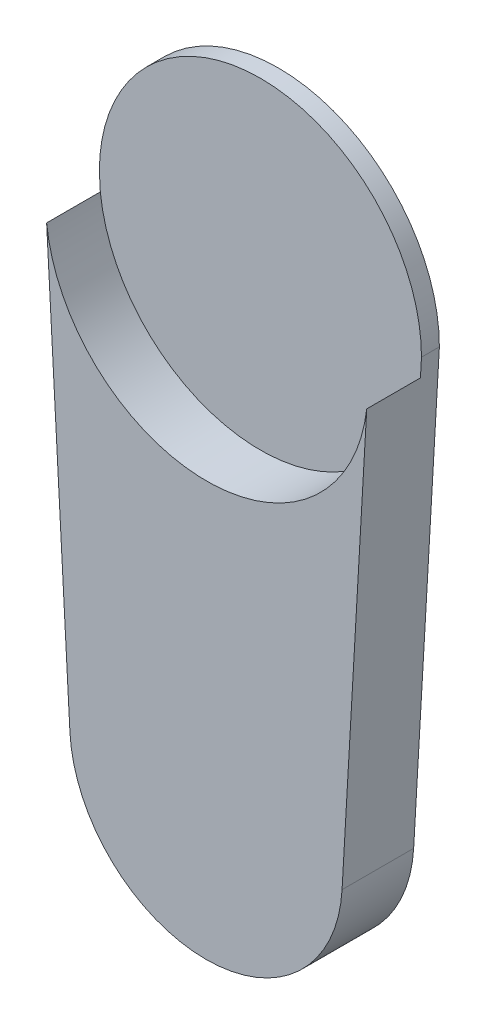
from build123d import *

# Parameters (mm, degrees)
BOSS_EXTRUDE3_DEPTH = 10
BOSS_EXTRUDE4_DEPTH = 30


with BuildPart() as part:
    # Sketch2 → Boss-Extrude3 (new body)
    with BuildSketch(Plane.XY):
        with BuildLine():
            ThreePointArc((90, 0), (0, 90), (-90, 0))
            Line((-90, 0), (-89.471097217, -9.742831353))
            ThreePointArc((-89.471097217, -9.742831353), (-0.289758357, -89.999533555), (89.406507913, -10.318737459))
            Line((89.406507913, -10.318737459), (90, 0))
        make_face()
        with BuildLine():
            ThreePointArc((89.406507913, -10.318737459), (-0.289758357, -89.999533555), (-89.471097217, -9.742831353))
            Line((-89.471097217, -9.742831353), (-76.448369593, -249.632359432))
            ThreePointArc((-76.448369593, -249.632359432), (-0.525900188, -321.66108657), (75.628074906, -249.877167959))
            Line((75.628074906, -249.877167959), (89.406507913, -10.318737459))
        make_face()
    extrude(amount=BOSS_EXTRUDE3_DEPTH)

    # Sketch3 → Boss-Extrude4 (add)
    with BuildSketch(Plane.XY.offset(10)):
        with BuildLine():
            ThreePointArc((89.406507913, -10.318737459), (-0.289758357, -89.999533555), (-89.471097217, -9.742831353))
            Line((-89.471097217, -9.742831353), (-76.448369593, -249.632359432))
            ThreePointArc((-76.448369593, -249.632359432), (-0.525900188, -321.66108657), (75.628074906, -249.877167959))
            Line((75.628074906, -249.877167959), (89.406507913, -10.318737459))
        make_face()
    extrude(amount=BOSS_EXTRUDE4_DEPTH)


solid = part.part
